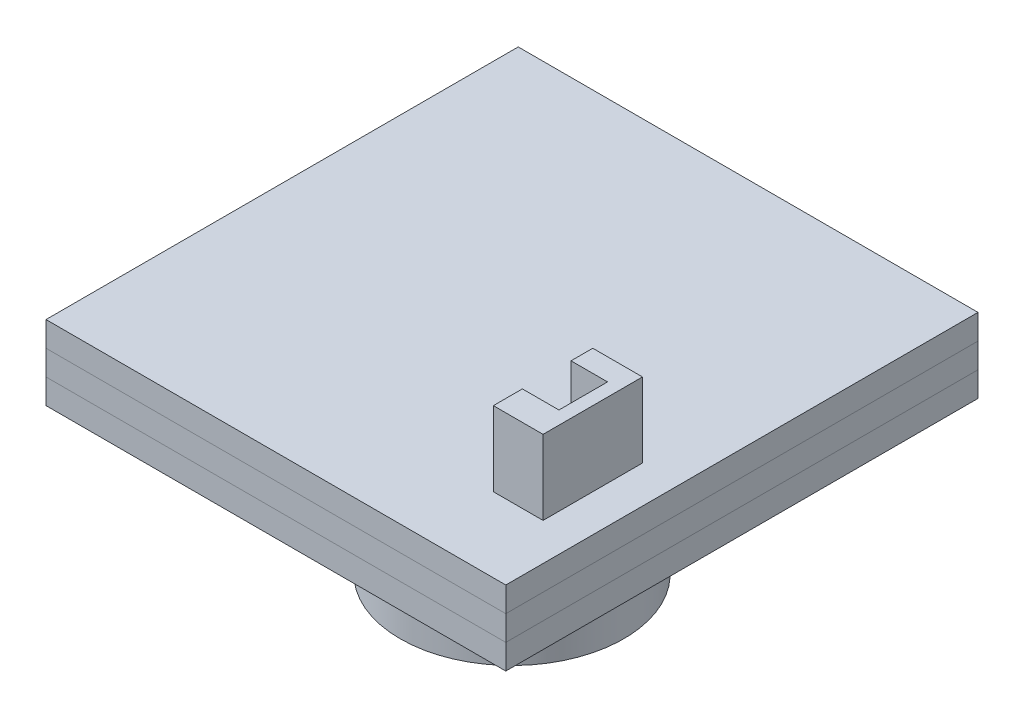
from build123d import *

# Parameters (mm, degrees)
SKETCH_1_W          = 53
SKETCH_1_H          = 38
SKETCH_1_R          = 1.5
EXTRUDE_1_DEPTH     = 2
SKETCH_2_W          = 37
SKETCH_2_H          = 38
EXTRUDE_2_DEPTH     = 2
SKETCH_3_W          = 37
SKETCH_3_H          = 38
EXTRUDE_3_DEPTH     = 2
EXTRUDE_4_DEPTH     = 6
SKETCH_5_R          = 1
EXTRUDE_5_DEPTH     = 4
SKETCH_6_R          = 9
EXTRUDE_6_DEPTH     = 8
SKETCH_7_R          = 6.62448747
CUT_EXTRUDE_1_DEPTH = 2
SKETCH1_W           = 16
SKETCH1_H           = 38
CUT_EXTRUDE1_DEPTH  = 10


with BuildPart() as part:
    # 草图1 → 凸台-拉伸1 (new body)
    with BuildSketch(Plane(origin=(0, 0, 0), x_dir=(1, 0, 0), z_dir=(0, 1, 0))):
        Rectangle(SKETCH_1_W, SKETCH_1_H)
        with Locations((21.5, 7.5)):
            Circle(SKETCH_1_R, mode=Mode.SUBTRACT)
        with Locations((21.5, -7.5)):
            Circle(SKETCH_1_R, mode=Mode.SUBTRACT)
    extrude(amount=EXTRUDE_1_DEPTH)

    # 草图5 → 凸台-拉伸5 (add)
    with BuildSketch(Plane.XZ):
        with BuildLine():
            Line((-6, 10), (-6, 8))
            Line((-6, 8), (0, 8))
            Line((0, 8), (0, -8))
            Line((0, -8), (-6, -8))
            Line((-6, -8), (-6, -10))
            ThreePointArc((-6, -10), (-8, -12), (-10, -10))
            Line((-10, -10), (-10, -8))
            Line((-10, -8), (-16, -8))
            Line((-16, -8), (-16, 8))
            Line((-16, 8), (-10, 8))
            Line((-10, 8), (-10, 10))
            ThreePointArc((-10, 10), (-8, 12), (-6, 10))
        make_face()
        with Locations((-8, 10)):
            Circle(SKETCH_5_R, mode=Mode.SUBTRACT)
        with Locations((-8, -10)):
            Circle(SKETCH_5_R, mode=Mode.SUBTRACT)
    extrude(amount=EXTRUDE_5_DEPTH)

    # 草图6 → 凸台-拉伸6 (add)
    with BuildSketch(Plane.XZ.offset(4)):
        with Locations((-8, 0)):
            Circle(SKETCH_6_R)
    extrude(amount=EXTRUDE_6_DEPTH)

    # 草图7 → 切除-拉伸1 (cut)
    with BuildSketch(Plane.XZ.offset(12)):
        with Locations((-8, 0)):
            Circle(SKETCH_7_R)
    extrude(amount=-CUT_EXTRUDE_1_DEPTH, mode=Mode.SUBTRACT)

    # 草图8 → 旋转1 (revolve)
    with BuildSketch(Plane(origin=(-8, 0, 0), x_dir=(0, -1, 0), z_dir=(1, 0, 0))):
        with BuildLine():
            Line((10, 0), (11.720143423, 0))
            add(Edge.make_bspline(
                [(10, -6.62448747), (11.859849746, -3.586362146), (11.720143423, 0)],
                knots=[0, 0, 0, 1, 1, 1], degree=2))
            Line((10, -6.62448747), (10, 0))
        make_face()
    revolve(axis=Axis((-8, -10, 0), (0, -1, 0)))

    # 草图9 → 切除-旋转1 (revolve, cut)
    with BuildSketch(Plane(origin=(-8, 0, 0), x_dir=(0, -1, 0), z_dir=(1, 0, 0))):
        with BuildLine():
            Line((6, -9), (7.5, -9))
            Line((7.5, -9), (7.5, -8.423402625))
            ThreePointArc((7.5, -8.423402625), (7.353553391, -8.069849234), (7, -7.923402625))
            Line((7, -7.923402625), (6.5, -7.923402625))
            ThreePointArc((6.5, -7.923402625), (6.146446609, -8.069849234), (6, -8.423402625))
            Line((6, -8.423402625), (6, -9))
        make_face()
    revolve(axis=Axis((-8, -6.28732061, 0), (0, -1, 0)), mode=Mode.SUBTRACT)

    # Sketch1 → Cut-Extrude1 (cut)
    with BuildSketch(Plane(origin=(0, 2, 0), x_dir=(1, 0, 0), z_dir=(0, 1, 0))):
        with Locations((18.5, 0)):
            Rectangle(SKETCH1_W, SKETCH1_H)
    extrude(amount=-CUT_EXTRUDE1_DEPTH, mode=Mode.SUBTRACT)


with BuildPart() as body_2:
    # 草图2 → 凸台-拉伸2 (new body)
    with BuildSketch(Plane(origin=(0, 2, 0), x_dir=(1, 0, 0), z_dir=(0, 1, 0))):
        with Locations((-8, 0)):
            Rectangle(SKETCH_2_W, SKETCH_2_H)
    extrude(amount=EXTRUDE_2_DEPTH)


with BuildPart() as body_3:
    # 草图3 → 凸台-拉伸3 (new body)
    with BuildSketch(Plane(origin=(0, 4, 0), x_dir=(1, 0, 0), z_dir=(0, 1, 0))):
        with Locations((-8, 0)):
            Rectangle(SKETCH_3_W, SKETCH_3_H)
    extrude(amount=EXTRUDE_3_DEPTH)

    # 草图4 → 凸台-拉伸4 (add)
    with BuildSketch(Plane(origin=(0, 6, 0), x_dir=(1, 0, 0), z_dir=(0, 1, 0))):
        Polygon((3.5, -10.664911908), (3.5, -13), (7.5, -13), (7.5, -5), (3.5, -5), (3.5, -6.751845124), (6.441233058, -6.751845124), (6.441233058, -10.664911908), align=None)
    extrude(amount=EXTRUDE_4_DEPTH)


solid = Compound([part.part, body_2.part, body_3.part])
